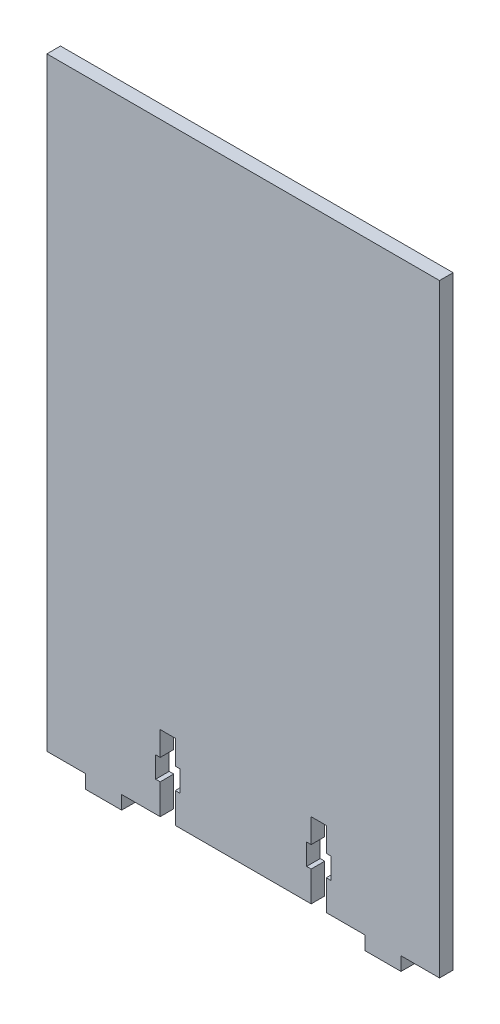
from build123d import *

# Parameters (mm, degrees)
SKETCH1_W           = 130
SKETCH1_H           = 200
BOSS_EXTRUDE1_DEPTH = 4.5
CUT_EXTRUDE1_DEPTH  = 120.353466644
SKETCH3_W           = 12
SKETCH3_H           = 4.5
BOSS_EXTRUDE2_DEPTH = 4.5


with BuildPart() as part:
    # Sketch1 → Boss-Extrude1 (new body)
    with BuildSketch(Plane.XY):
        Rectangle(SKETCH1_W, SKETCH1_H)
    extrude(amount=BOSS_EXTRUDE1_DEPTH)

    # Sketch2 → Cut-Extrude1 (cut, through all)
    with BuildSketch(Plane.XY.offset(4.5)):
        Polygon((-27.5, -90), (-27.5, -100), (-22.5, -100), (-22.5, -90), (-21, -90), (-21, -83), (-22.5, -83), (-22.5, -75), (-27.5, -75), (-27.5, -83), (-29, -83), (-29, -90), align=None)
    cut_extrude1 = extrude(amount=-CUT_EXTRUDE1_DEPTH, mode=Mode.SUBTRACT)

    # Mirror1: Cut-Extrude1 across plane
    add(cut_extrude1.mirror(Plane(origin=(0, 0, 0), x_dir=(0, 0, 1), z_dir=(1, 0, 0))), mode=Mode.SUBTRACT)

    # Sketch3 → Boss-Extrude2 (add)
    with BuildSketch(Plane.XY.offset(4.5)):
        with Locations((-46.25, -102.25)):
            Rectangle(SKETCH3_W, SKETCH3_H)
        with Locations((46.25, -102.25)):
            Rectangle(SKETCH3_W, SKETCH3_H)
    extrude(amount=-BOSS_EXTRUDE2_DEPTH)


solid = part.part
